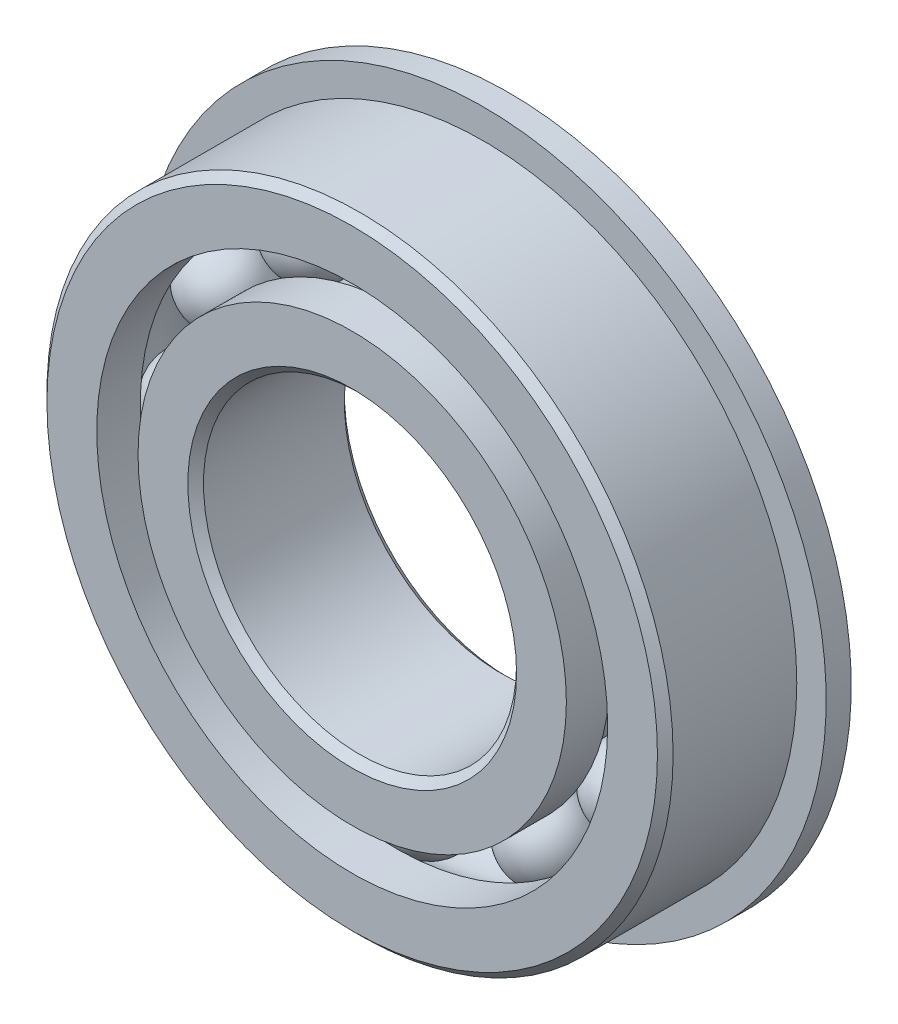
from build123d import *

# Parameters (mm, degrees)
CIRPATTERN1_COUNT = 12
SKETCH6_W         = 0.508
SKETCH6_H         = 1.765718681


with BuildPart() as part:
    # Sketch1 → Revolve1 (revolve)
    with BuildSketch(Plane(origin=(0, 0, 0), x_dir=(0, 0, -1), z_dir=(1, 0, 0))):
        with BuildLine():
            Line((1.42875, 6.35), (-1.42875, 6.35))
            Line((-1.42875, 6.35), (-1.5875, 6.19125))
            Line((-1.5875, 6.19125), (-1.5875, 5.181181319))
            Line((-1.5875, 5.181181319), (-0.705555556, 5.181181319))
            ThreePointArc((-0.705555556, 5.181181319), (0, 5.582928357), (0.705555556, 5.181181319))
            Line((0.705555556, 5.181181319), (1.5875, 5.181181319))
            Line((1.5875, 5.181181319), (1.5875, 6.19125))
            Line((1.5875, 6.19125), (1.42875, 6.35))
        make_face()
    revolve(axis=Axis((0, 0, 1.5875), (0, 0, -1)))

    # Sketch6 → Revolve6 (revolve)
    with BuildSketch(Plane(origin=(0, 0, 0), x_dir=(0, 0, -1), z_dir=(1, 0, 0))):
        with Locations((1.3335, 6.064040659)):
            Rectangle(SKETCH6_W, SKETCH6_H)
    revolve(axis=Axis((0, 0, -1.5875), (0, 0, 1)))


with BuildPart() as body_2:
    # Sketch3 → Revolve3 (revolve)
    with BuildSketch(Plane(origin=(0, 0, 0), x_dir=(0, 0, -1), z_dir=(1, 0, 0))):
        with BuildLine():
            Line((-1.5875, 4.343818681), (-0.705555556, 4.343818681))
            ThreePointArc((-0.705555556, 4.343818681), (0, 3.942071643), (0.705555556, 4.343818681))
            Line((0.705555556, 4.343818681), (1.5875, 4.343818681))
            Line((1.5875, 4.343818681), (1.5875, 3.33375))
            Line((1.5875, 3.33375), (1.42875, 3.175))
            Line((1.42875, 3.175), (-1.42875, 3.175))
            Line((-1.42875, 3.175), (-1.5875, 3.33375))
            Line((-1.5875, 3.33375), (-1.5875, 4.343818681))
        make_face()
    revolve(axis=Axis((0, 0, 1.5875), (0, 0, -1)))


with BuildPart() as body_3:
    # Sketch4 → Revolve4 (revolve)
    with BuildSketch(Plane(origin=(0, 0, 0), x_dir=(0, 0, -1), z_dir=(1, 0, 0))):
        with BuildLine():
            Line((-0.820428357, 4.7625), (0.820428357, 4.7625))
            ThreePointArc((0.820428357, 4.7625), (0, 5.582928357), (-0.820428357, 4.7625))
        make_face()
    revolve(axis=Axis((0, 4.7625, 0.820428357), (0, 0, -1)))


with BuildPart() as cirpattern1_1:
    # CirPattern1: pattern copy
    add(body_3.part.rotate(Axis((0, 0, -1.5875), (0, 0, 1)), 1 * 360 / CIRPATTERN1_COUNT))


with BuildPart() as cirpattern1_2:
    # CirPattern1: pattern copy
    add(body_3.part.rotate(Axis((0, 0, -1.5875), (0, 0, 1)), 2 * 360 / CIRPATTERN1_COUNT))


with BuildPart() as cirpattern1_3:
    # CirPattern1: pattern copy
    add(body_3.part.rotate(Axis((0, 0, -1.5875), (0, 0, 1)), 3 * 360 / CIRPATTERN1_COUNT))


with BuildPart() as cirpattern1_4:
    # CirPattern1: pattern copy
    add(body_3.part.rotate(Axis((0, 0, -1.5875), (0, 0, 1)), 4 * 360 / CIRPATTERN1_COUNT))


with BuildPart() as cirpattern1_5:
    # CirPattern1: pattern copy
    add(body_3.part.rotate(Axis((0, 0, -1.5875), (0, 0, 1)), 5 * 360 / CIRPATTERN1_COUNT))


with BuildPart() as cirpattern1_6:
    # CirPattern1: pattern copy
    add(body_3.part.rotate(Axis((0, 0, -1.5875), (0, 0, 1)), 6 * 360 / CIRPATTERN1_COUNT))


with BuildPart() as cirpattern1_7:
    # CirPattern1: pattern copy
    add(body_3.part.rotate(Axis((0, 0, -1.5875), (0, 0, 1)), 7 * 360 / CIRPATTERN1_COUNT))


with BuildPart() as cirpattern1_8:
    # CirPattern1: pattern copy
    add(body_3.part.rotate(Axis((0, 0, -1.5875), (0, 0, 1)), 8 * 360 / CIRPATTERN1_COUNT))


with BuildPart() as cirpattern1_9:
    # CirPattern1: pattern copy
    add(body_3.part.rotate(Axis((0, 0, -1.5875), (0, 0, 1)), 9 * 360 / CIRPATTERN1_COUNT))


with BuildPart() as cirpattern1_10:
    # CirPattern1: pattern copy
    add(body_3.part.rotate(Axis((0, 0, -1.5875), (0, 0, 1)), 10 * 360 / CIRPATTERN1_COUNT))


with BuildPart() as cirpattern1_11:
    # CirPattern1: pattern copy
    add(body_3.part.rotate(Axis((0, 0, -1.5875), (0, 0, 1)), 11 * 360 / CIRPATTERN1_COUNT))


solid = Compound([part.part, body_2.part, body_3.part, cirpattern1_1.part, cirpattern1_2.part, cirpattern1_3.part, cirpattern1_4.part, cirpattern1_5.part, cirpattern1_6.part, cirpattern1_7.part, cirpattern1_8.part, cirpattern1_9.part, cirpattern1_10.part, cirpattern1_11.part])
